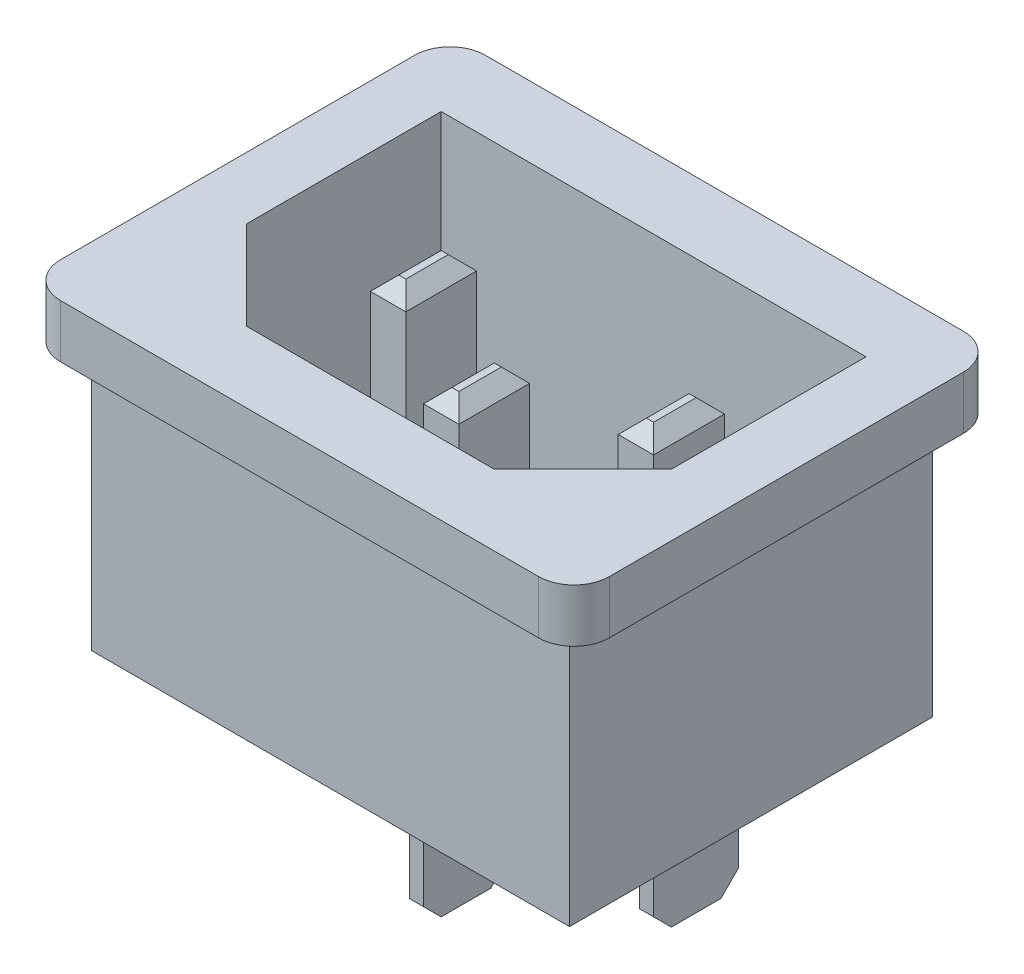
from build123d import *

# Parameters (mm, degrees)
SKETCH_1_W          = 27
SKETCH_1_H          = 20.5
EXTRUDE_1_DEPTH     = 15
SKETCH_2_W          = 0.8
SKETCH_2_H          = 4.8
EXTRUDE_2_DEPTH     = 9
CHAMFER_1_SIZE      = 1
SKETCH_3_W          = 31
SKETCH_3_H          = 24
EXTRUDE_3_DEPTH     = 3
CUT_EXTRUDE_1_DEPTH = 17
SKETCH_5_W          = 2
SKETCH_5_H          = 4
EXTRUDE_4_DEPTH     = 15
CHAMFER_2_SIZE      = 0.8
FILLET_1_R          = 2


with BuildPart() as part:
    # Эскиз1 → Бобышка-Вытянуть1 (new body)
    with BuildSketch(Plane(origin=(0, 0, 0), x_dir=(1, 0, 0), z_dir=(0, 1, 0))):
        Rectangle(SKETCH_1_W, SKETCH_1_H)
    extrude(amount=EXTRUDE_1_DEPTH)

    # Эскиз2 → Бобышка-Вытянуть2 (add)
    with BuildSketch(Plane.XZ):
        with Locations((0, 3)):
            Rectangle(SKETCH_2_W, SKETCH_2_H)
        with Locations((-7, -3)):
            Rectangle(SKETCH_2_W, SKETCH_2_H)
        with Locations((7, -3)):
            Rectangle(SKETCH_2_W, SKETCH_2_H)
    extrude(amount=EXTRUDE_2_DEPTH)

    # Фаска1
    chamfer_1_edges = [part.edges().sort_by_distance(p)[0] for p in [
        (-7, -9, -0.6),
        (-7, -9, -5.4),
        (0, -9, 5.4),
        (0, -9, 0.6),
        (7, -9, -0.6),
        (7, -9, -5.4),
    ]]
    chamfer(chamfer_1_edges, length=CHAMFER_1_SIZE)

    # Эскиз3 → Бобышка-Вытянуть3 (add)
    with BuildSketch(Plane(origin=(0, 15, 0), x_dir=(1, 0, 0), z_dir=(0, 1, 0))):
        Rectangle(SKETCH_3_W, SKETCH_3_H)
    extrude(amount=EXTRUDE_3_DEPTH)

    # Эскиз4 → Вырез-Вытянуть1 (cut)
    with BuildSketch(Plane(origin=(0, 18, 0), x_dir=(1, 0, 0), z_dir=(0, 1, 0))):
        Polygon((12, -3), (7, -8), (-7, -8), (-12, -3), (-12, 8), (12, 8), align=None)
    extrude(amount=-CUT_EXTRUDE_1_DEPTH, mode=Mode.SUBTRACT)

    # Эскиз5 → Бобышка-Вытянуть4 (add)
    with BuildSketch(Plane(origin=(0, 1, 0), x_dir=(1, 0, 0), z_dir=(0, 1, 0))):
        with Locations((7, 2)):
            Rectangle(SKETCH_5_W, SKETCH_5_H)
        with Locations((0, -2)):
            Rectangle(SKETCH_5_W, SKETCH_5_H)
        with Locations((-7, 2)):
            Rectangle(SKETCH_5_W, SKETCH_5_H)
    extrude(amount=EXTRUDE_4_DEPTH)

    # Фаска2
    chamfer_2_edges = [part.edges().sort_by_distance(p)[0] for p in [
        (-1, 16, 2),
        (0, 16, 4),
        (1, 16, 2),
        (0, 16, 0),
        (6, 16, -2),
        (7, 16, 0),
        (8, 16, -2),
        (7, 16, -4),
        (-7, 16, -4),
        (-8, 16, -2),
        (-7, 16, 0),
        (-6, 16, -2),
    ]]
    chamfer(chamfer_2_edges, length=CHAMFER_2_SIZE)

    # Скругление1
    fillet_1_edges = [part.edges().sort_by_distance(p)[0] for p in [
        (-15.5, 16.5, -12),
        (-15.5, 16.5, 12),
        (15.5, 16.5, 12),
        (15.5, 16.5, -12),
    ]]
    fillet(fillet_1_edges, radius=FILLET_1_R)


solid = part.part
